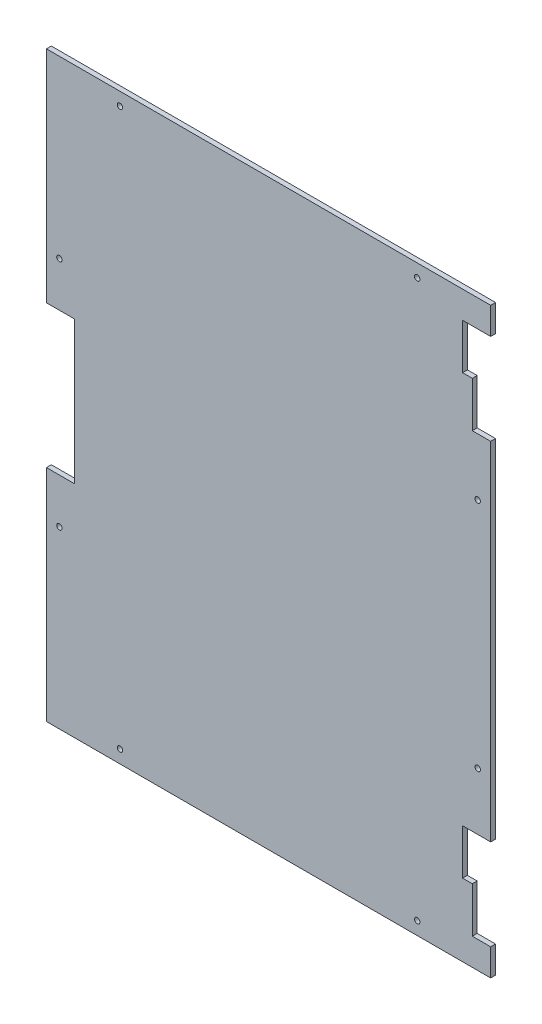
from build123d import *

# Parameters (mm, degrees)
SKETCH1_R           = 2.5
BOSS_EXTRUDE1_DEPTH = 4.5


with BuildPart() as part:
    # Sketch1 → Boss-Extrude1 (new body)
    with BuildSketch(Plane.XY):
        Polygon((-206.5, 269.5), (204.5, 269.5), (204.5, 244.5), (178.5, 244.5), (178.5, 202.5), (187.5, 202.5), (187.5, 160.5), (204.5, 160.5), (204.5, -160.5), (178.5, -160.5), (178.5, -202.5), (187.5, -202.5), (187.5, -244.5), (204.5, -244.5), (204.5, -269.5), (-206.5, -269.5), (-206.5, -244.5), (-206.5, -160.5), (-206.5, -66), (-180.5, -66), (-180.5, 66), (-206.5, 66), (-206.5, 160.5), (-206.5, 244.5), align=None)
        with Locations((136.5, -257.5)):
            Circle(SKETCH1_R, mode=Mode.SUBTRACT)
        with Locations(Location((-138.5, -257.5, 0), (0, 0, 180))):
            Circle(SKETCH1_R, mode=Mode.SUBTRACT)
        with Locations((-138.5, 257.5)):
            Circle(SKETCH1_R, mode=Mode.SUBTRACT)
        with Locations(Location((136.5, 257.5, 0), (0, 0, 180))):
            Circle(SKETCH1_R, mode=Mode.SUBTRACT)
        with Locations((-194.5, 107.5)):
            Circle(SKETCH1_R, mode=Mode.SUBTRACT)
        with Locations(Location((-194.5, -107.5, 0), (0, 0, 180))):
            Circle(SKETCH1_R, mode=Mode.SUBTRACT)
        with Locations(Location((192.5, 107.5, 0), (0, 0, 180))):
            Circle(SKETCH1_R, mode=Mode.SUBTRACT)
        with Locations((192.5, -107.5)):
            Circle(SKETCH1_R, mode=Mode.SUBTRACT)
    extrude(amount=BOSS_EXTRUDE1_DEPTH)


solid = part.part
